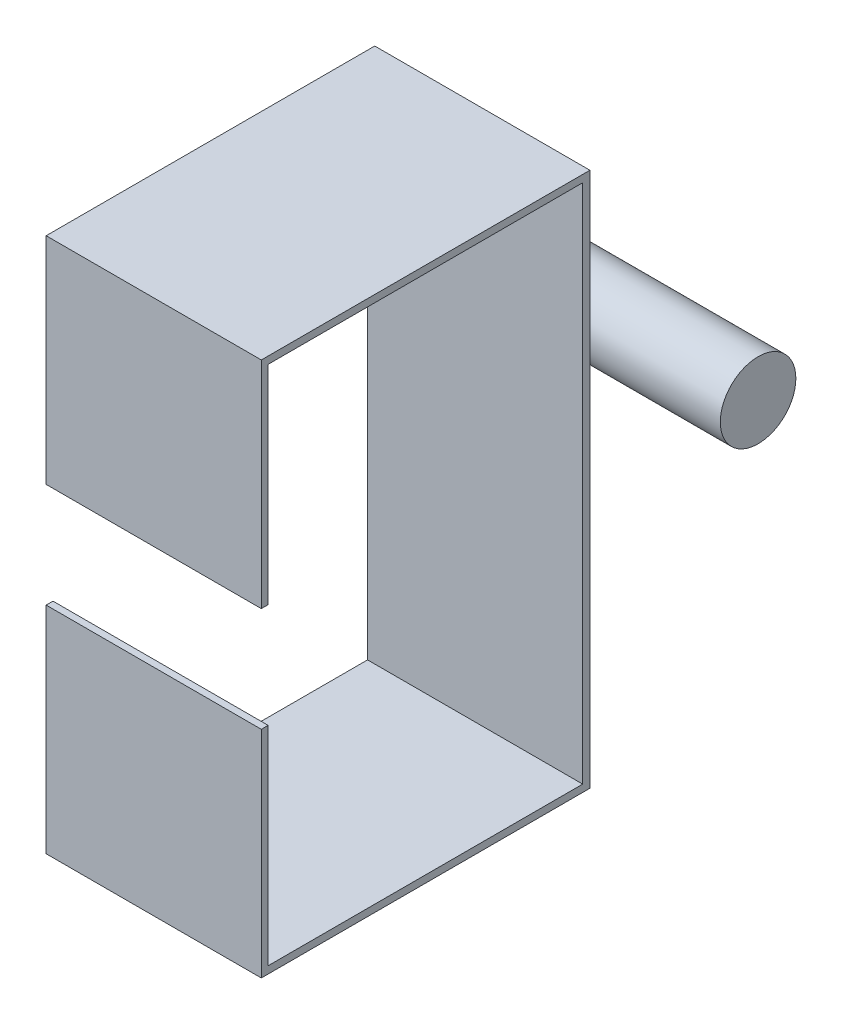
from build123d import *

# Parameters (mm, degrees)
BOSS_EXTRUDE1_DEPTH = 26.04516
BOSS_EXTRUDE2_DEPTH = 2.54
SKETCH5_R           = 4.572
BOSS_EXTRUDE3_DEPTH = 27.94


with BuildPart() as part:
    # Sketch1 → Boss-Extrude1 (new body)
    with BuildSketch(Plane.YZ):
        Polygon((-32.39516, 0), (32.39516, 0), (32.39516, 39.7764), (6.3246, 39.7764), (6.3246, 38.94836), (31.5214, 38.94836), (31.5214, 0.87376), (-31.5214, 0.87376), (-31.5214, 38.94836), (-6.3246, 38.94836), (-6.3246, 39.7764), (-32.39516, 39.7764), align=None)
    extrude(amount=BOSS_EXTRUDE1_DEPTH)

    # Sketch2 → Boss-Extrude2 (add)
    with BuildSketch(Plane.YZ):
        with BuildLine():
            Line((-4.5339, 0), (4.5339, 0))
            Line((4.5339, 0), (4.5339, -19.05))
            ThreePointArc((4.5339, -19.05), (0, -23.032988294), (-4.5339, -19.05))
            Line((-4.5339, -19.05), (-4.5339, 0))
        make_face()
    extrude(amount=BOSS_EXTRUDE2_DEPTH)

    # Sketch5 → Boss-Extrude3 (add)
    with BuildSketch(Plane.YZ):
        with Locations(Location((0, -18.460988294, 0), (0, 0, 7.401999688))):
            Circle(SKETCH5_R)
    extrude(amount=BOSS_EXTRUDE3_DEPTH)


solid = part.part
